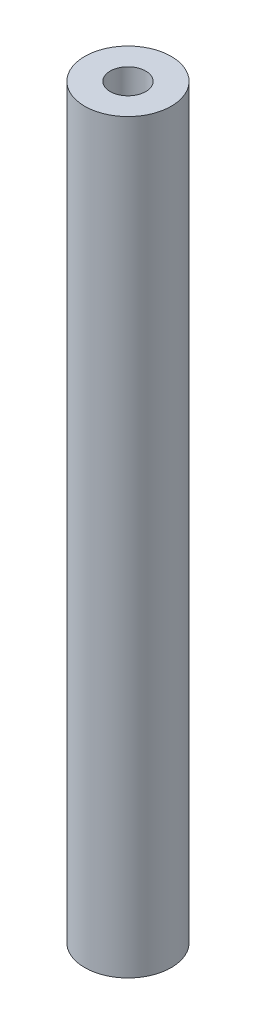
from build123d import *

# Parameters (mm, degrees)
SKETCH1_R               = 12.75
BOSS_EXTRUDE1_DEPTH     = 220
CUT_EXTRUDE1_DEPTH      = 221.737683688
CUT_EXTRUDE1_DEPTH_BACK = 221.737683688
SKETCH2_R               = 5.25


with BuildPart() as part:
    # Sketch1 → Boss-Extrude1 (new body)
    with BuildSketch(Plane(origin=(0, 0, 0), x_dir=(1, 0, 0), z_dir=(0, 1, 0))):
        with Locations(Location((0, 0, 0), (0, 0, 270))):
            Circle(SKETCH1_R)
    extrude(amount=BOSS_EXTRUDE1_DEPTH)

    # Sketch2 → Cut-Extrude1 (cut, two sides: drawn at the far end of the back side and taken through both)
    with BuildSketch(Plane(origin=(0, 0, 0), x_dir=(1, 0, 0), z_dir=(0, 1, 0)).offset(-CUT_EXTRUDE1_DEPTH_BACK)):
        with Locations(Location((0, 0, 0), (0, 0, 270))):
            Circle(SKETCH2_R)
    extrude(amount=CUT_EXTRUDE1_DEPTH + CUT_EXTRUDE1_DEPTH_BACK, mode=Mode.SUBTRACT)


solid = part.part
